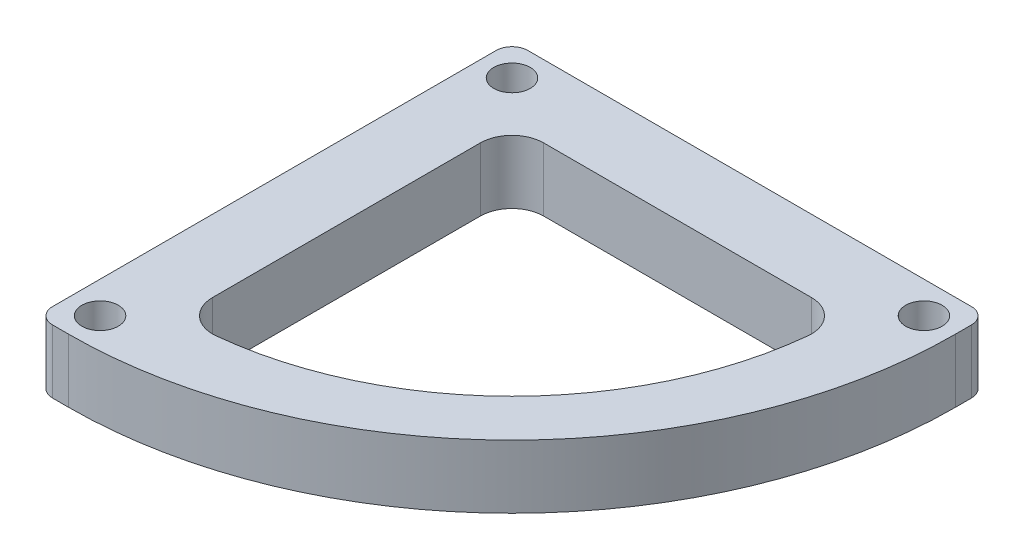
from build123d import *

# Parameters (mm, degrees)
SKETCH_1_W          = 30
SKETCH_1_H          = 30
SKETCH_1_R          = 1.15
EXTRUDE_1_DEPTH     = 4
FILLET_1_R          = 28
FILLET_2_R          = 1
CUT_EXTRUDE_3_DEPTH = 22


with BuildPart() as part:
    # 草图1 → 凸台-拉伸1 (new body)
    with BuildSketch(Plane(origin=(0, 0, 0), x_dir=(1, 0, 0), z_dir=(0, 1, 0))):
        Rectangle(SKETCH_1_W, SKETCH_1_H)
        with Locations(Location((13, 13, 0), (0, 0, 270))):
            Circle(SKETCH_1_R, mode=Mode.SUBTRACT)
        with Locations(Location((13, -13, 0), (0, 0, 90))):
            Circle(SKETCH_1_R, mode=Mode.SUBTRACT)
        with Locations(Location((-13, -13, 0), (0, 0, 270))):
            Circle(SKETCH_1_R, mode=Mode.SUBTRACT)
        with Locations(Location((-13, 13, 0), (0, 0, 90))):
            Circle(SKETCH_1_R, mode=Mode.SUBTRACT)
    extrude(amount=EXTRUDE_1_DEPTH)

    # 圆角1
    fillet_1_edges = [part.edges().sort_by_distance(p)[0] for p in [
        (15, 2, 15),
    ]]
    fillet(fillet_1_edges, radius=FILLET_1_R)

    # 圆角2
    fillet_2_edges = [part.edges().sort_by_distance(p)[0] for p in [
        (-15, 2, 15),
        (-15, 2, -15),
        (15, 2, -15),
    ]]
    fillet(fillet_2_edges, radius=FILLET_2_R)

    # 草图2 → 切除-拉伸3 (cut)
    with BuildSketch(Plane(origin=(0, 0, 0), x_dir=(1, 0, 0), z_dir=(0, 1, 0))):
        with BuildLine():
            Line((8.447221814, 10.447221814), (-8.447221814, 10.447221814))
            ThreePointArc((-8.447221814, 10.447221814), (-9.861435376, 9.861435376), (-10.447221814, 8.447221814))
            Line((-10.447221814, 8.447221814), (-10.447221814, -8.447221814))
            ThreePointArc((-10.447221814, -8.447221814), (-9.784933922, -9.934005697), (-8.236695498, -10.436110617))
            ThreePointArc((-8.236695498, -10.436110617), (4.402020591, -4.402020591), (10.436110617, 8.236695498))
            ThreePointArc((10.436110617, 8.236695498), (9.934005697, 9.784933922), (8.447221814, 10.447221814))
        make_face()
    extrude(amount=CUT_EXTRUDE_3_DEPTH, mode=Mode.SUBTRACT)


solid = part.part
